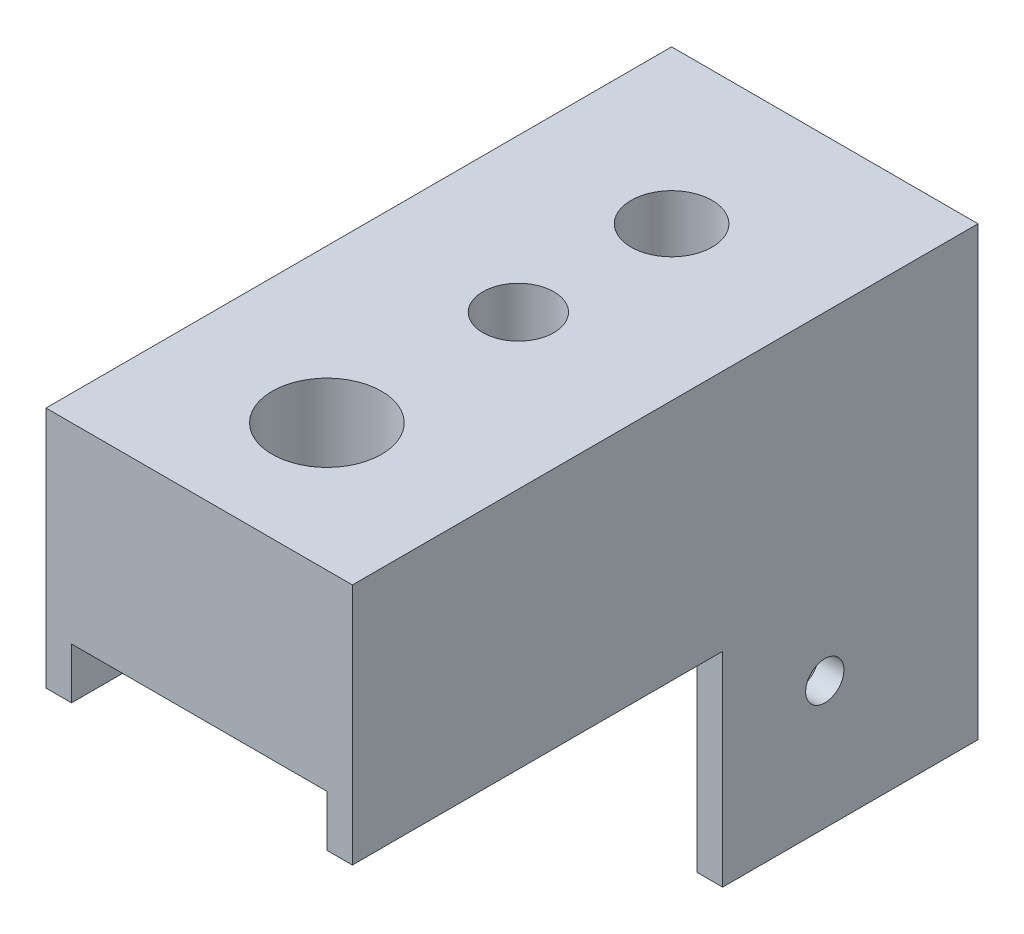
from build123d import *

# Parameters (mm, degrees)
BOSS_EXTRUDE1_DEPTH = 10
BOSS_EXTRUDE2_DEPTH = 2
SKETCH4_R           = 4.285
SKETCH4_R_2         = 2.78
SKETCH4_R_3         = 3.175
CUT_EXTRUDE1_DEPTH  = 50.799598392
SKETCH5_R           = 1.5
CUT_EXTRUDE2_DEPTH  = 65.124878168


with BuildPart() as part:
    # Sketch2 → Boss-Extrude1 (new, symmetric)
    with BuildSketch(Plane(origin=(0, 0, 0), x_dir=(0, 0, -1), z_dir=(1, 0, 0))):
        Polygon((-44, 0), (0, 0), (0, -20), (5, -20), (5, 15), (-44, 15), align=None)
    extrude(amount=BOSS_EXTRUDE1_DEPTH, both=True)

    # Sketch3 → Boss-Extrude2 (add)
    with BuildSketch(Plane(origin=(10, 0, 0), x_dir=(0, 0, -1), z_dir=(1, 0, 0))):
        Polygon((-44, 15), (-44, -4), (-15, -4), (-15, -20), (5, -20), (5, 15), align=None)
    boss_extrude2 = extrude(amount=BOSS_EXTRUDE2_DEPTH)

    # Mirror1: Boss-Extrude2 across plane
    add(boss_extrude2.mirror(Plane(origin=(0, 0, 0), x_dir=(0, 0, 1), z_dir=(1, 0, 0))))

    # Sketch4 → Cut-Extrude1 (cut, through all)
    with BuildSketch(Plane.XZ):
        with Locations(Location((0, 34, 0), (0, 0, 270))):
            Circle(SKETCH4_R)
        with Locations(Location((0, 19, 0), (0, 0, 270))):
            Circle(SKETCH4_R_2)
        with Locations(Location((0, 7, 0), (0, 0, 270))):
            Circle(SKETCH4_R_3)
    extrude(amount=-CUT_EXTRUDE1_DEPTH, mode=Mode.SUBTRACT)

    # Sketch5 → Cut-Extrude2 (cut, through all)
    with BuildSketch(Plane(origin=(12, 0, -12), x_dir=(0, 0, 1), z_dir=(-1, 0, 0))):
        with Locations(Location((19, -10, 0), (0, 0, 180))):
            Circle(SKETCH5_R)
    extrude(amount=CUT_EXTRUDE2_DEPTH, mode=Mode.SUBTRACT)


solid = part.part
